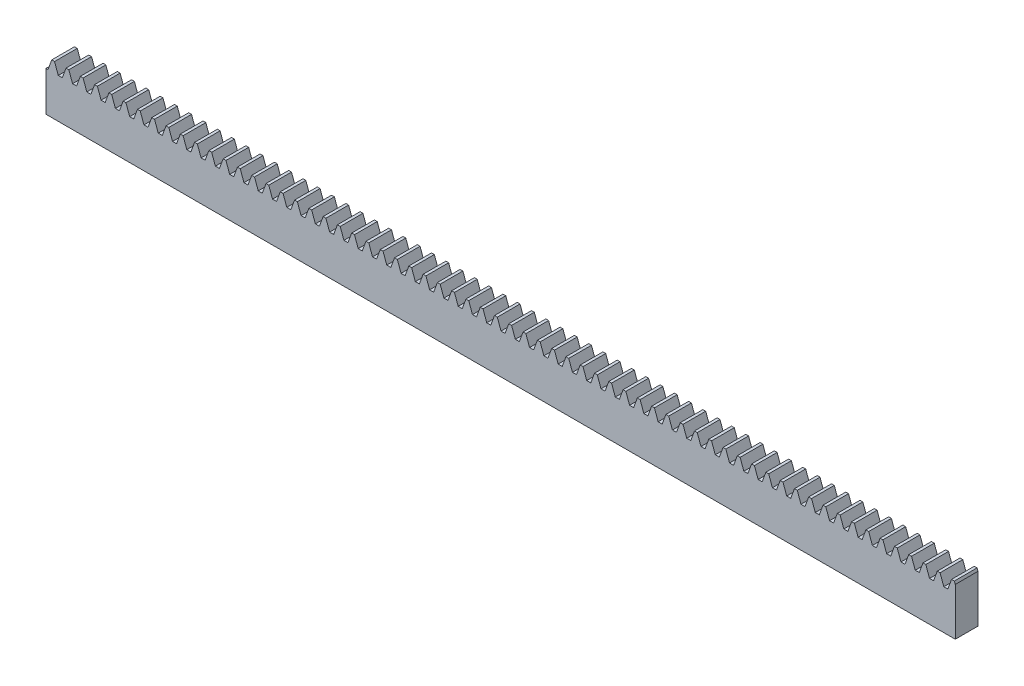
from build123d import *

# Parameters (mm, degrees)
BLANKSKE_W        = 200
BLANKSKE_H        = 11
BLANK_DEPTH       = 5
TOOTHCUTSIM_DEPTH = 201.364667544
TEETHCUTS_COUNT   = 65
TEETHCUTS_PITCH   = 3.14159265


with BuildPart() as part:
    # BlankSke → Blank (new body)
    with BuildSketch(Plane.XY):
        with Locations((100, 5.5)):
            Rectangle(BLANKSKE_W, BLANKSKE_H)
    extrude(amount=-BLANK_DEPTH)

    # TooCutSkeSim → ToothCutSim (cut, through all)
    with BuildSketch(Plane.XY):
        Polygon((0.44443537, 8.75), (-0.44443537, 8.75), (-1.272613241, 11.0254), (1.272613241, 11.0254), align=None)
    toothcutsim = extrude(amount=-TOOTHCUTSIM_DEPTH, mode=Mode.SUBTRACT)

    # TeethCuts: ToothCutSim ×65
    with Locations(*[(i * TEETHCUTS_PITCH, 0, 0) for i in range(1, TEETHCUTS_COUNT)]):
        add(toothcutsim, mode=Mode.SUBTRACT)


solid = part.part
